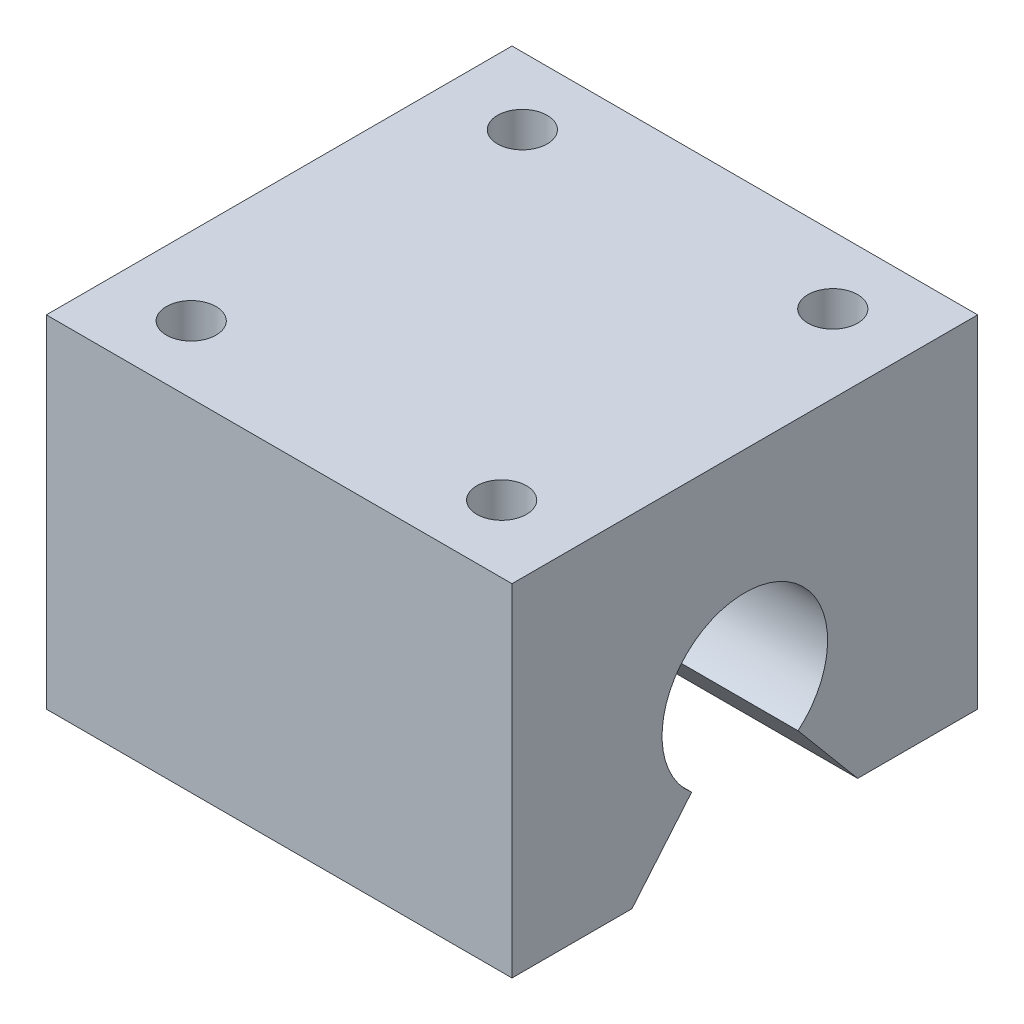
from build123d import *

# Parameters (mm, degrees)
EXTRUDE_1_DEPTH     = 45
SKETCH_2_R          = 2.4
CUT_EXTRUDE_1_DEPTH = 9


with BuildPart() as part:
    # Эскиз1 → Бобышка-Вытянуть1 (new body)
    with BuildSketch(Plane(origin=(0, 0, 0), x_dir=(0, 0, -1), z_dir=(1, 0, 0))):
        with BuildLine():
            Line((-22.5, 20), (22.5, 20))
            Line((22.5, 20), (22.5, -13))
            Line((22.5, -13), (10.908295205, -13))
            Line((10.908295205, -13), (5.142300877, -6.128355545))
            ThreePointArc((5.142300877, -6.128355545), (0, 8), (-5.142300877, -6.128355545))
            Line((-5.142300877, -6.128355545), (-10.908295205, -13))
            Line((-10.908295205, -13), (-22.5, -13))
            Line((-22.5, -13), (-22.5, 20))
        make_face()
    extrude(amount=EXTRUDE_1_DEPTH)

    # Эскиз2 → Вырез-Вытянуть1 (cut)
    with BuildSketch(Plane(origin=(0, 20, 0), x_dir=(1, 0, 0), z_dir=(0, 1, 0))):
        with Locations((7.5, 16)):
            Circle(SKETCH_2_R)
        with Locations((37.5, 16)):
            Circle(SKETCH_2_R)
        with Locations((37.5, -16)):
            Circle(SKETCH_2_R)
        with Locations((7.5, -16)):
            Circle(SKETCH_2_R)
    extrude(amount=-CUT_EXTRUDE_1_DEPTH, mode=Mode.SUBTRACT)


solid = part.part
